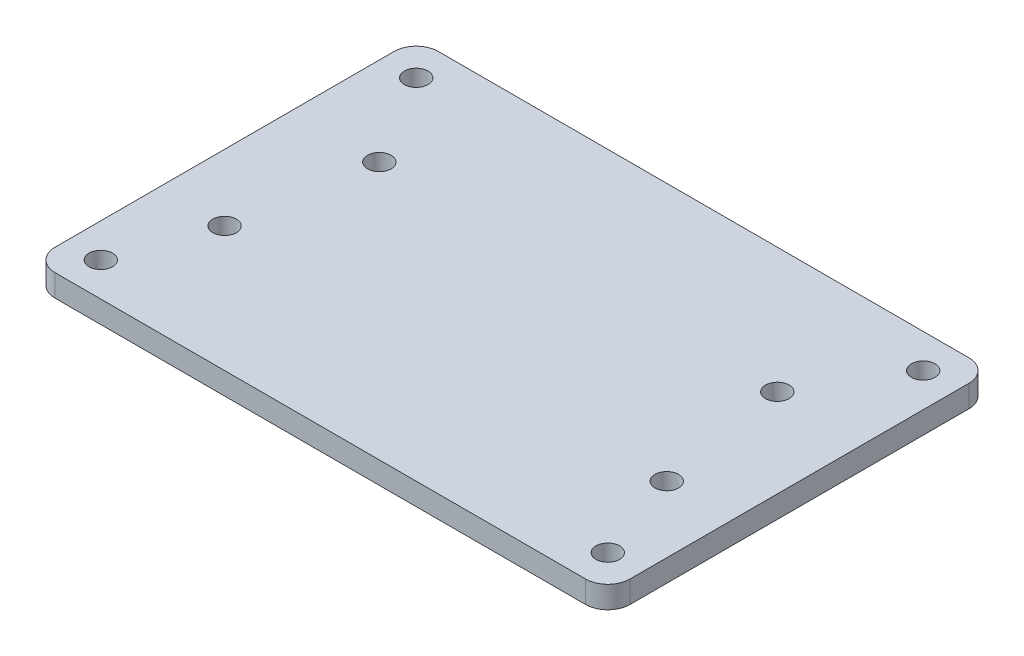
from build123d import *

# Parameters (mm, degrees)
SKETCH_1_W          = 78
SKETCH_1_H          = 52
EXTRUDE_1_DEPTH     = 3
SKETCH_2_R          = 1.6
CUT_EXTRUDE_1_DEPTH = 3
SKETCH_7_R          = 1.6
CUT_EXTRUDE_2_DEPTH = 3
FILLET_1_R          = 3


with BuildPart() as part:
    # 草图1 → 凸台-拉伸1 (new body)
    with BuildSketch(Plane(origin=(0, 0, 0), x_dir=(1, 0, 0), z_dir=(0, 1, 0))):
        Rectangle(SKETCH_1_W, SKETCH_1_H)
    extrude(amount=EXTRUDE_1_DEPTH)

    # 草图2 → 切除-拉伸1 (cut)
    with BuildSketch(Plane(origin=(0, 3, 0), x_dir=(1, 0, 0), z_dir=(0, 1, 0))):
        with BuildLine():
            ThreePointArc((-32.8, 21.4), (-33.26862915, 22.53137085), (-34.4, 23))
            Line((-34.4, 23), (-34.4, 21.4))
            Line((-34.4, 21.4), (-36, 21.4))
            ThreePointArc((-36, 21.4), (-34.4, 19.8), (-32.8, 21.4))
        make_face()
        with BuildLine():
            Line((-34.4, 21.4), (-34.4, 23))
            ThreePointArc((-34.4, 23), (-35.53137085, 22.53137085), (-36, 21.4))
            Line((-36, 21.4), (-34.4, 21.4))
        make_face()
        with BuildLine():
            ThreePointArc((36, 21.4), (35.53137085, 22.53137085), (34.4, 23))
            Line((34.4, 23), (34.4, 21.4))
            Line((34.4, 21.4), (36, 21.4))
        make_face()
        with BuildLine():
            Line((34.4, 21.4), (34.4, 23))
            ThreePointArc((34.4, 23), (33.26862915, 20.26862915), (36, 21.4))
            Line((36, 21.4), (34.4, 21.4))
        make_face()
        with BuildLine():
            ThreePointArc((36, -21.4), (33.26862915, -20.26862915), (34.4, -23))
            Line((34.4, -23), (34.4, -21.4))
            Line((34.4, -21.4), (36, -21.4))
        make_face()
        with BuildLine():
            Line((34.4, -21.4), (34.4, -23))
            ThreePointArc((34.4, -23), (35.53137085, -22.53137085), (36, -21.4))
            Line((36, -21.4), (34.4, -21.4))
        make_face()
        with Locations(Location((-34.4, -21.4, 0), (0, 0, 270))):
            Circle(SKETCH_2_R)
    extrude(amount=-CUT_EXTRUDE_1_DEPTH, mode=Mode.SUBTRACT)

    # 草图7 → 切除-拉伸2 (cut)
    with BuildSketch(Plane(origin=(0, 3, 0), x_dir=(1, 0, 0), z_dir=(0, 1, 0))):
        with Locations(Location((-30, -9, 0), (0, 0, 270))):
            Circle(SKETCH_7_R)
        with Locations(Location((-27, 9, 0), (0, 0, 270))):
            Circle(SKETCH_7_R)
        with Locations(Location((27, 9, 0), (0, 0, 270))):
            Circle(SKETCH_7_R)
        with Locations(Location((30, -9, 0), (0, 0, 270))):
            Circle(SKETCH_7_R)
    extrude(amount=-CUT_EXTRUDE_2_DEPTH, mode=Mode.SUBTRACT)

    # 圆角1
    fillet_1_edges = [part.edges().sort_by_distance(p)[0] for p in [
        (39, 1.5, 26),
        (-39, 1.5, 26),
        (-39, 1.5, -26),
        (39, 1.5, -26),
    ]]
    fillet(fillet_1_edges, radius=FILLET_1_R)


solid = part.part
